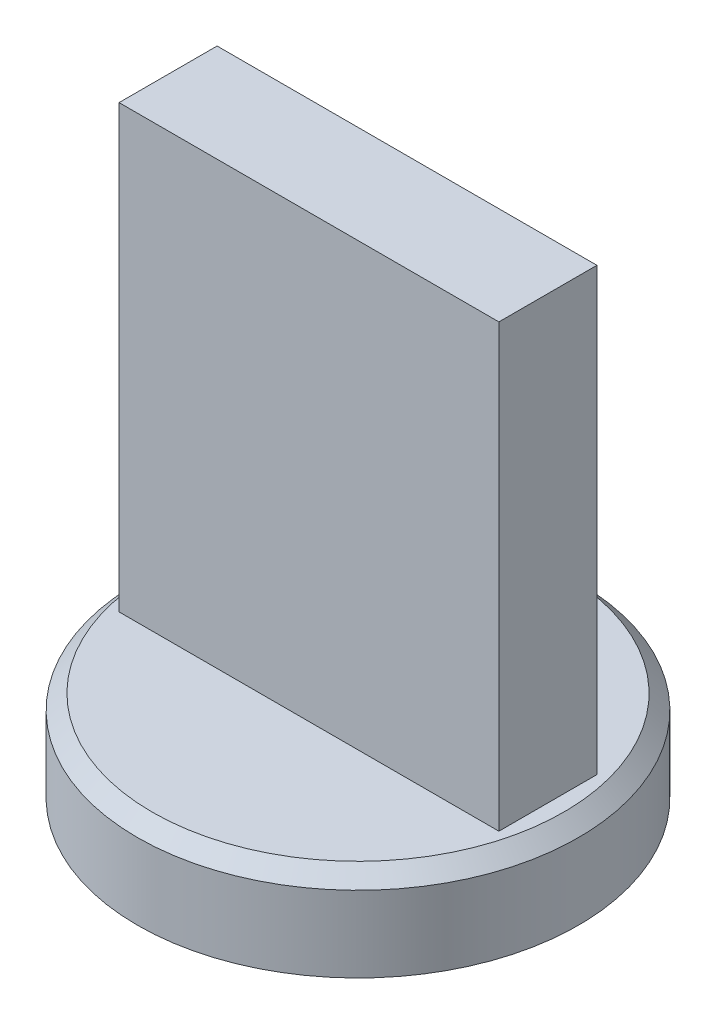
from build123d import *

# Parameters (mm, degrees)
SKETCH2_R           = 90
BOSS_EXTRUDE1_DEPTH = 37
CHAMFER1_SIZE       = 6
SKETCH3_W           = 155
SKETCH3_H           = 40
BOSS_EXTRUDE2_DEPTH = 180
SKETCH30_R          = 15
CUT_EXTRUDE1_DEPTH  = 20
SKETCH31_R          = 15
CUT_EXTRUDE2_DEPTH  = 20


with BuildPart() as part:
    # Sketch2 → Boss-Extrude1 (new body)
    with BuildSketch(Plane(origin=(0, 0, 0), x_dir=(1, 0, 0), z_dir=(0, 1, 0))):
        with Locations(Location((0, 0, 0), (0, 0, 270))):
            Circle(SKETCH2_R)
    extrude(amount=BOSS_EXTRUDE1_DEPTH)

    # Chamfer1
    chamfer1_edges = [part.edges().sort_by_distance(p)[0] for p in [
        (0, 37, -90),
    ]]
    chamfer(chamfer1_edges, length=CHAMFER1_SIZE)

    # Sketch3 → Boss-Extrude2 (add)
    with BuildSketch(Plane(origin=(0, 37, 0), x_dir=(1, 0, 0), z_dir=(0, 1, 0))):
        Rectangle(SKETCH3_W, SKETCH3_H)
    extrude(amount=BOSS_EXTRUDE2_DEPTH)

    # Sketch30 → Cut-Extrude1 (cut)
    with BuildSketch(Plane.XZ):
        with Locations(Location((0, 0, 0), (0, 0, 270))):
            Circle(SKETCH30_R)
    extrude(amount=-CUT_EXTRUDE1_DEPTH, mode=Mode.SUBTRACT)

    # Sketch31 → Cut-Extrude2 (cut)
    with BuildSketch(Plane(origin=(0, 0, -20), x_dir=(-1, 0, 0), z_dir=(0, 0, -1))):
        with Locations((0, 197)):
            Circle(SKETCH31_R)
    extrude(amount=-CUT_EXTRUDE2_DEPTH, mode=Mode.SUBTRACT)


solid = part.part
